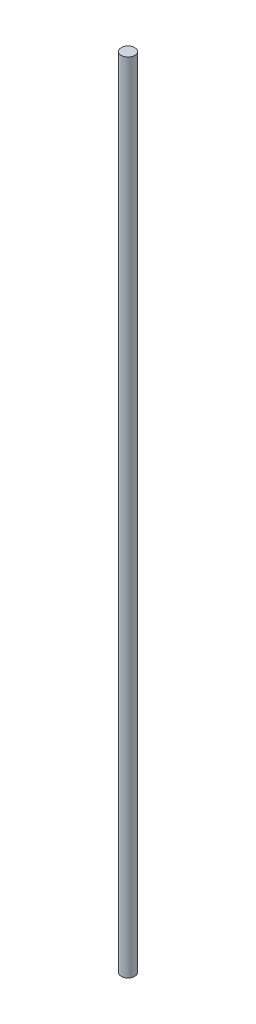
from build123d import *

# Parameters (mm, degrees)
SKETCH_1_R      = 2
EXTRUDE_1_DEPTH = 235


with BuildPart() as part:
    # Эскиз1 → Бобышка-Вытянуть1 (new body)
    with BuildSketch(Plane(origin=(0, 0, 0), x_dir=(1, 0, 0), z_dir=(0, 1, 0))):
        with Locations(Location((0, 0, 0), (0, 0, 90))):
            Circle(SKETCH_1_R)
    extrude(amount=EXTRUDE_1_DEPTH)


solid = part.part
